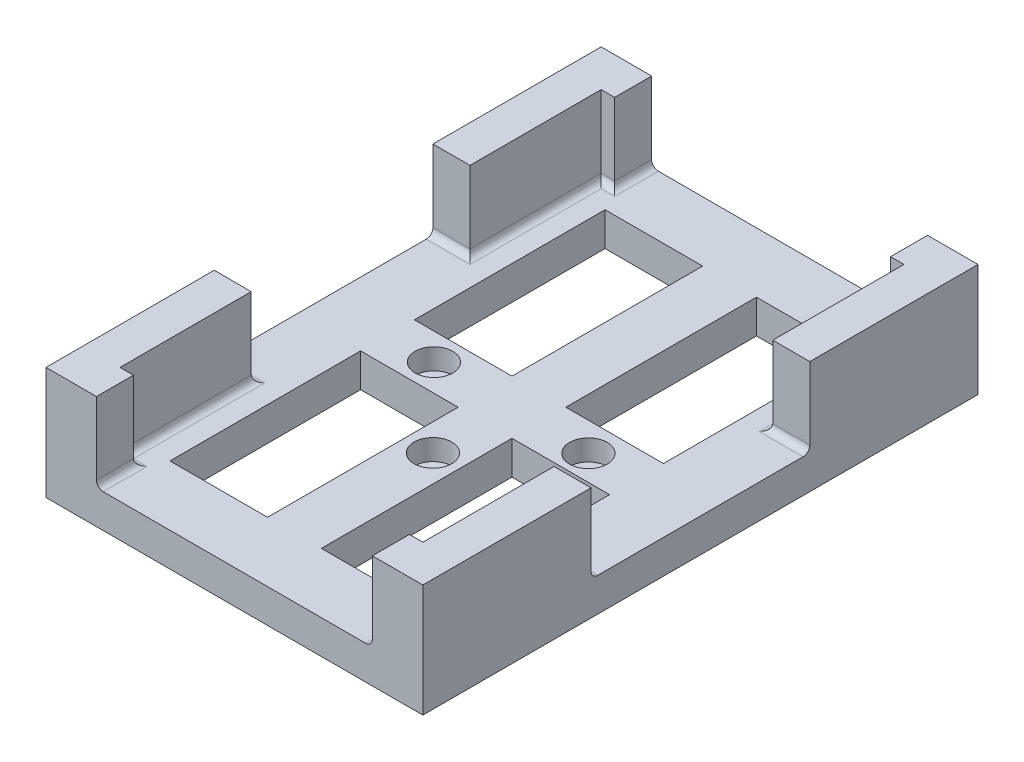
from build123d import *

# Parameters (mm, degrees)
SKETCH1_W           = 56
SKETCH1_H           = 82.5
SKETCH1_R           = 1.55
BOSS_EXTRUDE1_DEPTH = 5
SKETCH2_W           = 56
SKETCH2_H           = 82.5
SKETCH2_W_2         = 45
SKETCH2_H_2         = 71.5
BOSS_EXTRUDE2_DEPTH = 11.75
SKETCH3_W           = 5.5
SKETCH3_H           = 32.5
SKETCH3_W_2         = 41
SKETCH3_H_2         = 5.5
CUT_EXTRUDE1_DEPTH  = 11.75
FILLET1_R           = 1
SKETCH5_R           = 2.8
CUT_EXTRUDE2_DEPTH  = 3.1
SKETCH6_W           = 14.5
SKETCH6_H           = 28.330895985
CUT_EXTRUDE4_DEPTH  = 52.221333446


with BuildPart() as part:
    # Sketch1 → Boss-Extrude1 (new body)
    with BuildSketch(Plane(origin=(0, 0, 0), x_dir=(1, 0, 0), z_dir=(0, 1, 0))):
        Rectangle(SKETCH1_W, SKETCH1_H)
        with Locations(Location((-11.6, 0, 0), (0, 0, 270))):
            Circle(SKETCH1_R, mode=Mode.SUBTRACT)
        with Locations(Location((0, -11.75, 0), (0, 0, 270))):
            Circle(SKETCH1_R, mode=Mode.SUBTRACT)
        with Locations(Location((11.6, -0.25, 0), (0, 0, 270))):
            Circle(SKETCH1_R, mode=Mode.SUBTRACT)
    extrude(amount=BOSS_EXTRUDE1_DEPTH)

    # Sketch2 → Boss-Extrude2 (add)
    with BuildSketch(Plane(origin=(0, 5, 0), x_dir=(1, 0, 0), z_dir=(0, 1, 0))):
        Rectangle(SKETCH2_W, SKETCH2_H)
        Rectangle(SKETCH2_W_2, SKETCH2_H_2, mode=Mode.SUBTRACT)
    extrude(amount=BOSS_EXTRUDE2_DEPTH)

    # Sketch3 → Cut-Extrude1 (cut)
    with BuildSketch(Plane(origin=(0, 16.75, 0), x_dir=(1, 0, 0), z_dir=(0, 1, 0))):
        with Locations((-25.25, 0)):
            Rectangle(SKETCH3_W, SKETCH3_H)
        with Locations((0, 38.5)):
            Rectangle(SKETCH3_W_2, SKETCH3_H_2)
        with Locations((0, -38.5)):
            Rectangle(SKETCH3_W_2, SKETCH3_H_2)
        with Locations((25.25, 0)):
            Rectangle(SKETCH3_W, SKETCH3_H)
    extrude(amount=-CUT_EXTRUDE1_DEPTH, mode=Mode.SUBTRACT)

    # Fillet1
    fillet1_edges = [part.edges().sort_by_distance(p)[0] for p in [
        (22.5, 5, 26),
        (21.5, 5, -35.75),
        (-22.5, 5, -26),
        (-21.5, 5, 35.75),
        (21.5, 5, 35.75),
        (-22.5, 5, 26),
        (-21.5, 5, -35.75),
        (22.5, 5, -26),
        (-25.25, 5, 16.25),
        (-25.25, 5, -16.25),
        (20.5, 5, -38.5),
        (-20.5, 5, -38.5),
        (20.5, 5, 38.5),
        (-20.5, 5, 38.5),
        (25.25, 5, 16.25),
        (25.25, 5, -16.25),
    ]]
    fillet(fillet1_edges, radius=FILLET1_R)

    # Sketch5 → Cut-Extrude2 (cut)
    with BuildSketch(Plane(origin=(0, 5, 0), x_dir=(1, 0, 0), z_dir=(0, 1, 0))):
        with Locations(Location((-11.6, 0, 0), (0, 0, 270))):
            Circle(SKETCH5_R)
        with Locations(Location((11.6, -0.25, 0), (0, 0, 270))):
            Circle(SKETCH5_R)
        with Locations(Location((0, -11.75, 0), (0, 0, 270))):
            Circle(SKETCH5_R)
    extrude(amount=-CUT_EXTRUDE2_DEPTH, mode=Mode.SUBTRACT)

    # Sketch6 → Cut-Extrude4 (cut, through all)
    with BuildSketch(Plane(origin=(0, 5, 0), x_dir=(1, 0, 0), z_dir=(0, 1, 0))):
        with Locations((-11.25, 18.165447993)):
            Rectangle(SKETCH6_W, SKETCH6_H)
        with Locations((11.25, 18.165447993)):
            Rectangle(SKETCH6_W, SKETCH6_H)
        with Locations((11.25, -18.165447993)):
            Rectangle(SKETCH6_W, SKETCH6_H)
        with Locations((-11.25, -18.165447993)):
            Rectangle(SKETCH6_W, SKETCH6_H)
    extrude(amount=-CUT_EXTRUDE4_DEPTH, mode=Mode.SUBTRACT)


solid = part.part
